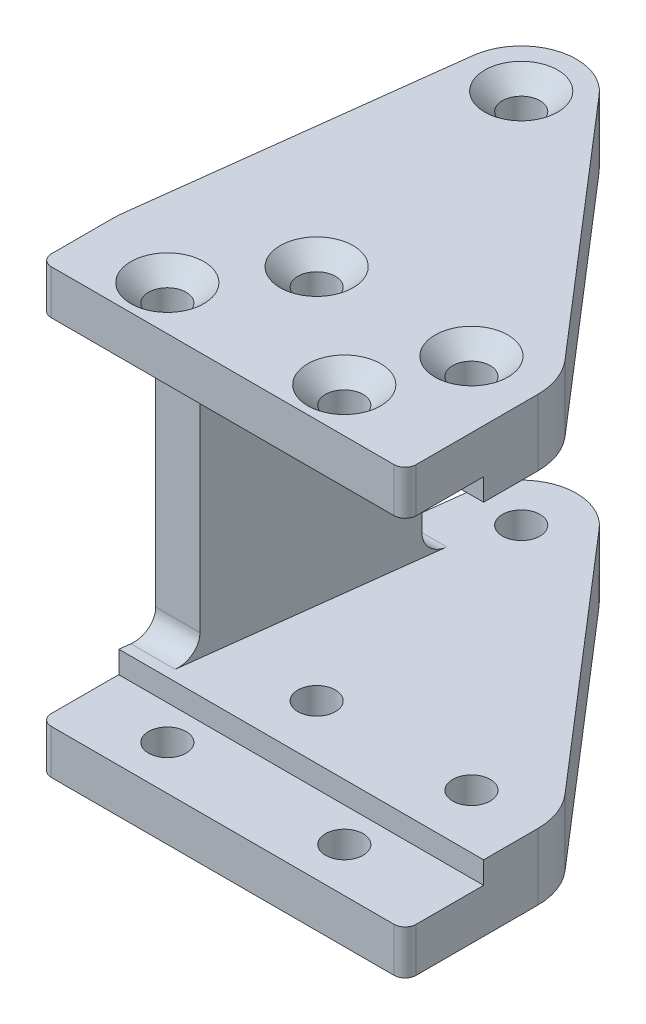
from build123d import *

# Parameters (mm, degrees)
SKETCH_1_R                   = 1.7
EXTRUDE_1_DEPTH              = 6
EXTRUDE_3_DEPTH              = 14
FILLET_1_R                   = 1
FILLET_2_R                   = 10
HOLE_WIZARD_M3_1_D           = 3.4
HOLE_WIZARD_M3_1_DEPTH       = 20
HOLE_WIZARD_M3_1_CSINK_D     = 6.6
HOLE_WIZARD_M3_1_CSINK_ANGLE = 90
SKETCH_14_W                  = 15
SKETCH_14_H                  = 32
CUT_EXTRUDE_3_DEPTH          = 60.506302187
FILLET_3_R                   = 2


with BuildPart() as part:
    # 草图1 → 凸台-拉伸1 (new body)
    with BuildSketch(Plane(origin=(0, 0, 0), x_dir=(1, 0, 0), z_dir=(0, 1, 0))):
        with BuildLine():
            Line((-15.5, 3), (-15.5, -4))
            Line((-15.5, -4), (15.5, -4))
            Line((15.5, -4), (17.5, -4))
            Line((17.5, -4), (17.5, 8))
            ThreePointArc((17.5, 8), (17.124551632, 10.089119178), (16.045193687, 11.916786227))
            Line((16.045193687, 11.916786227), (-3.212338594, 34.263988522))
            ThreePointArc((-3.212338594, 34.263988522), (-8.449526575, 35.78527666), (-11.962215367, 31.613529665))
            Line((-11.962215367, 31.613529665), (-15.5, 3))
        make_face()
        with Locations(Location((-8, 0, 0), (0, 0, 270))):
            Circle(SKETCH_1_R, mode=Mode.SUBTRACT)
        with Locations(Location((-2.5, 8, 0), (0, 0, 270))):
            Circle(SKETCH_1_R, mode=Mode.SUBTRACT)
        with Locations(Location((8, 0, 0), (0, 0, 270))):
            Circle(SKETCH_1_R, mode=Mode.SUBTRACT)
        with Locations(Location((11.5, 8, 0), (0, 0, 270))):
            Circle(SKETCH_1_R, mode=Mode.SUBTRACT)
        with Locations(Location((-7, 31, 0), (0, 0, 270))):
            Circle(SKETCH_1_R, mode=Mode.SUBTRACT)
    extrude(amount=EXTRUDE_1_DEPTH)

    # 草图3 → 凸台-拉伸3 (add)
    with BuildSketch(Plane.XZ):
        Polygon((-15.120670115, -6.068012339), (-12.911963321, -23.931987661), (-8.911963321, -23.931987661), (-11.120670115, -6.068012339), align=None)
    extrude(amount=EXTRUDE_3_DEPTH)

    # 圆角1
    fillet_1_edges = [part.edges().sort_by_distance(p)[0] for p in [
        (17.5, 3, 4),
        (-15.5, 3, 4),
    ]]
    fillet(fillet_1_edges, radius=FILLET_1_R)

    # 圆角2
    fillet_2_edges = [part.edges().sort_by_distance(p)[0] for p in [
        (-15.5, 3, -3),
    ]]
    fillet(fillet_2_edges, radius=FILLET_2_R)

    # M3 十字槽半沉头木螺钉的锥形沉头孔1
    with Locations(Plane(origin=(0, 6, 0), x_dir=(1, 0, 0), z_dir=(0, 1, 0))):
        with Locations((-2.5, 8), (11.5, 8), (8, 0), (-8, 0), (-7, 31)):
            CounterSinkHole(HOLE_WIZARD_M3_1_D / 2, HOLE_WIZARD_M3_1_CSINK_D / 2, depth=HOLE_WIZARD_M3_1_DEPTH, counter_sink_angle=HOLE_WIZARD_M3_1_CSINK_ANGLE)

    # 镜向1: part across plane


with BuildPart() as part_1:
    add(part.part)
    add(part.part.mirror(Plane(origin=(0, -14, 0), x_dir=(0, 0, 1), z_dir=(0, -1, 0))))

    # 草图14 → 切除-拉伸3 (cut, through all)
    with BuildSketch(Plane(origin=(17.5, 0, 0), x_dir=(0, 0, -1), z_dir=(1, 0, 0))):
        with Locations((-4.4, -14)):
            Rectangle(SKETCH_14_W, SKETCH_14_H)
    extrude(amount=-CUT_EXTRUDE_3_DEPTH, mode=Mode.SUBTRACT)

    # 圆角3
    fillet_3_edges = [part_1.edges().sort_by_distance(p)[0] for p in [
        (-10.911963321, -28, -23.931987661),
        (-13.120670115, -28, -6.068012339),
        (-13.120670115, 0, -6.068012339),
        (-10.911963321, 0, -23.931987661),
    ]]
    fillet(fillet_3_edges, radius=FILLET_3_R)


solid = part_1.part
